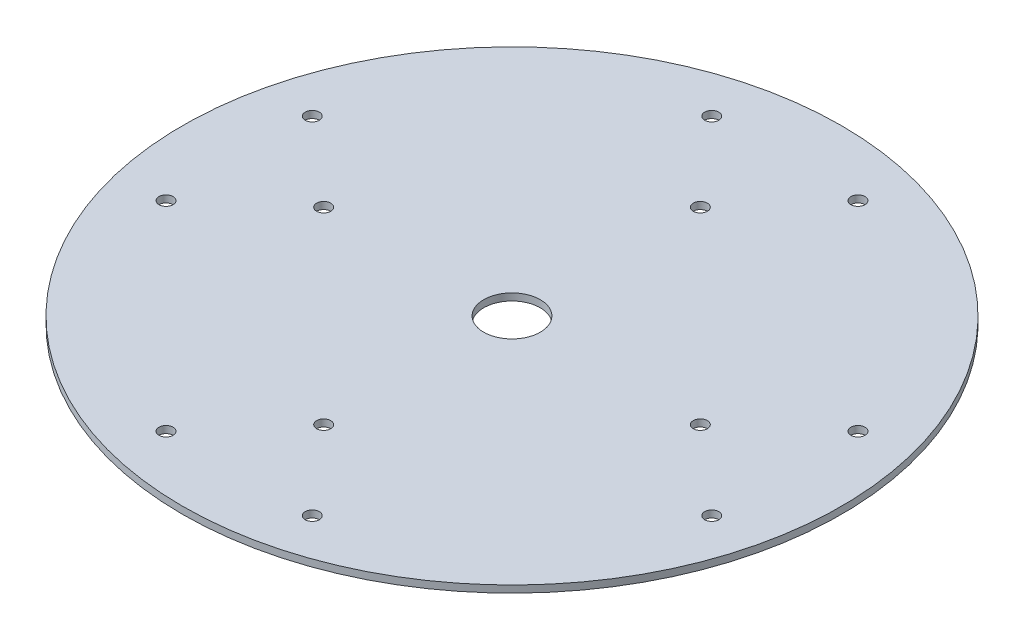
from build123d import *

# Parameters (mm, degrees)
SKETCH1_R           = 70
SKETCH1_R_2         = 6
SKETCH1_R_3         = 1.5
BOSS_EXTRUDE1_DEPTH = 1.5


with BuildPart() as part:
    # Sketch1 → Boss-Extrude1 (new body)
    with BuildSketch(Plane(origin=(0, 0, 0), x_dir=(1, 0, 0), z_dir=(0, 1, 0))):
        with Locations(Location((0, 0, 0), (0, 0, 270))):
            Circle(SKETCH1_R)
        with Locations(Location((0, 0, 0), (0, 0, 270))):
            Circle(SKETCH1_R_2, mode=Mode.SUBTRACT)
        with Locations(Location((0, 40, 0), (0, 0, 270))):
            Circle(SKETCH1_R_3, mode=Mode.SUBTRACT)
        with Locations(Location((-15.529142706, 57.955549577, 0), (0, 0, 270))):
            Circle(SKETCH1_R_3, mode=Mode.SUBTRACT)
        with Locations(Location((15.529142706, 57.955549577, 0), (0, 0, 270))):
            Circle(SKETCH1_R_3, mode=Mode.SUBTRACT)
        with Locations(Location((40, 0, 0), (0, 0, 270))):
            Circle(SKETCH1_R_3, mode=Mode.SUBTRACT)
        with Locations(Location((57.955549577, 15.529142706, 0), (0, 0, 270))):
            Circle(SKETCH1_R_3, mode=Mode.SUBTRACT)
        with Locations(Location((57.955549577, -15.529142706, 0), (0, 0, 270))):
            Circle(SKETCH1_R_3, mode=Mode.SUBTRACT)
        with Locations(Location((0, -40, 0), (0, 0, 270))):
            Circle(SKETCH1_R_3, mode=Mode.SUBTRACT)
        with Locations(Location((15.529142706, -57.955549577, 0), (0, 0, 270))):
            Circle(SKETCH1_R_3, mode=Mode.SUBTRACT)
        with Locations(Location((-15.529142706, -57.955549577, 0), (0, 0, 270))):
            Circle(SKETCH1_R_3, mode=Mode.SUBTRACT)
        with Locations(Location((-40, 0, 0), (0, 0, 270))):
            Circle(SKETCH1_R_3, mode=Mode.SUBTRACT)
        with Locations(Location((-57.955549577, -15.529142706, 0), (0, 0, 270))):
            Circle(SKETCH1_R_3, mode=Mode.SUBTRACT)
        with Locations(Location((-57.955549577, 15.529142706, 0), (0, 0, 270))):
            Circle(SKETCH1_R_3, mode=Mode.SUBTRACT)
    extrude(amount=BOSS_EXTRUDE1_DEPTH)


solid = part.part
